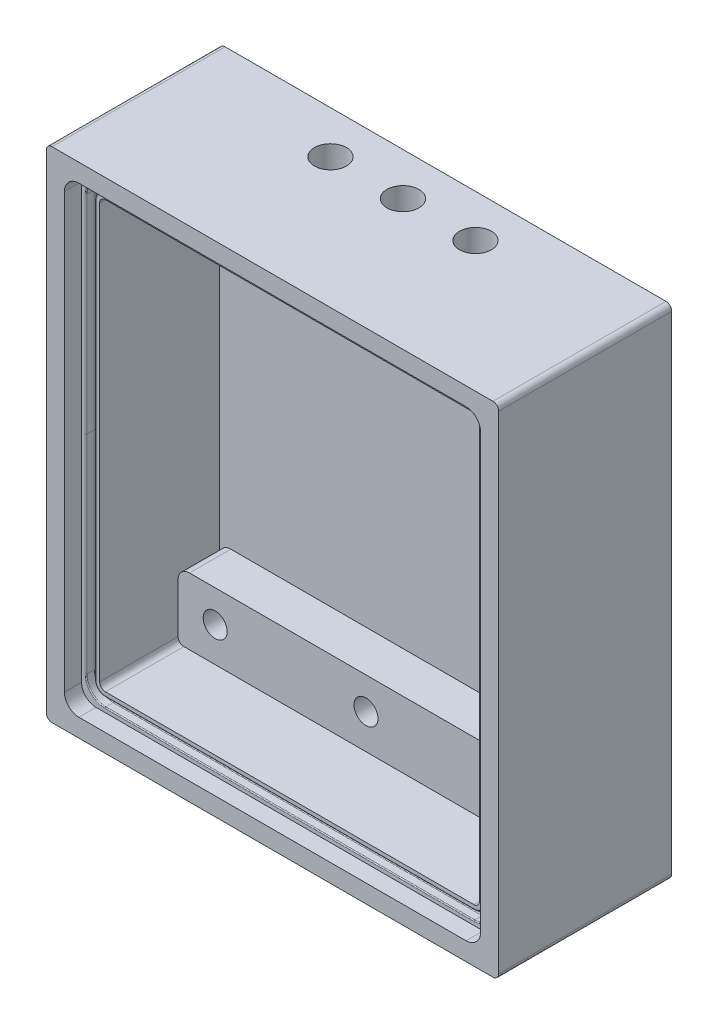
from build123d import *

# Parameters (mm, degrees)
BOSS_EXTRUDE2_DEPTH      = 20.32
BOSS_EXTRUDE2_DEPTH_BACK = 10
SKETCH1_W                = 79.247997513
SKETCH1_H                = 87.375993957
SHELL2_T                 = -6.35
SKETCH2_W                = 66.547997513
SKETCH2_H                = 11.66
BOSS_EXTRUDE3_DEPTH      = 7.23
FILLET1_R                = 1
FILLET2_R                = 2
FILLET3_R                = 2
SKETCH3_R                = 2.1
CUT_EXTRUDE2_DEPTH       = 5
CUT_EXTRUDE3_DEPTH       = 3
SKETCH5_W                = 1.5875
SKETCH5_H                = 3.175
SKETCH7_R                = 2.8067
CUT_EXTRUDE4_DEPTH       = 4.699
FILLET4_R                = 0.15875
FILLET5_R                = 0.15875


with BuildPart() as part:
    # Sketch1 → Boss-Extrude2 (new, two sides: drawn at the far end of the back side and taken through both)
    with BuildSketch(Plane.XY.offset(-BOSS_EXTRUDE2_DEPTH_BACK)):
        with Locations((52.069998742, 103.917747498)):
            Rectangle(SKETCH1_W, SKETCH1_H)
    extrude(amount=BOSS_EXTRUDE2_DEPTH + BOSS_EXTRUDE2_DEPTH_BACK)

    # Shell2
    shell2_openings = [part.faces().sort_by_distance(p)[0] for p in [
        (52.069998741, 103.917747498, 20.32),
    ]]
    offset(amount=SHELL2_T, openings=shell2_openings, kind=Kind.INTERSECTION)

    # Fillet1
    fillet1_edges = [part.edges().sort_by_distance(p)[0] for p in [
        (18.795999985, 66.579750519, 8.335),
        (18.795999985, 141.255744476, 8.335),
        (85.343997498, 141.255744476, 8.335),
        (85.343997498, 66.579750519, 8.335),
        (12.445999985, 147.605744476, 5.16),
        (91.693997498, 147.605744476, 5.16),
        (91.693997498, 60.229750519, 5.16),
        (12.445999985, 60.229750519, 5.16),
    ]]
    fillet(fillet1_edges, radius=FILLET1_R)

    # Sketch4 → Cut-Extrude3 (cut)
    with BuildSketch(Plane.XY.offset(20.32)):
        with BuildLine():
            Line((18.160999985, 144.430744476), (85.978997498, 144.430744476))
            ThreePointArc((85.978997498, 144.430744476), (87.775048722, 143.686795701), (88.518997498, 141.890744476))
            Line((88.518997498, 141.890744476), (88.518997498, 65.944750519))
            ThreePointArc((88.518997498, 65.944750519), (87.775048722, 64.148699295), (85.978997498, 63.404750519))
            Line((85.978997498, 63.404750519), (18.160999985, 63.404750519))
            ThreePointArc((18.160999985, 63.404750519), (16.364948761, 64.148699295), (15.620999985, 65.944750519))
            Line((15.620999985, 65.944750519), (15.620999985, 141.890744476))
            ThreePointArc((15.620999985, 141.890744476), (16.364948761, 143.686795701), (18.160999985, 144.430744476))
        make_face()
    extrude(amount=-CUT_EXTRUDE3_DEPTH, mode=Mode.SUBTRACT)

    # Cut-Sweep1: sweep along a path in Sketch6
    with BuildLine(Plane.XY.offset(17.32)) as cut_sweep1_path:
        Line((19.748499985, 142.843244476), (84.391497498, 142.843244476))
        ThreePointArc((84.391497498, 142.843244476), (86.187548722, 142.099295701), (86.931497498, 140.303244476))
        Line((86.931497498, 140.303244476), (86.931497498, 67.532250519))
        ThreePointArc((86.931497498, 67.532250519), (86.187548722, 65.736199295), (84.391497498, 64.992250519))
        Line((84.391497498, 64.992250519), (19.748499985, 64.992250519))
        ThreePointArc((19.748499985, 64.992250519), (17.952448761, 65.736199295), (17.208499985, 67.532250519))
        Line((17.208499985, 67.532250519), (17.208499985, 140.303244476))
        ThreePointArc((17.208499985, 140.303244476), (17.952448761, 142.099295701), (19.748499985, 142.843244476))
    # Sketch5 → Cut-Sweep1 (sweep, cut)
    with BuildSketch(Plane(origin=(0, 103.917747498, 0), x_dir=(1, 0, 0), z_dir=(0, 1, 0))):
        with Locations((17.208499985, -17.32)):
            Rectangle(SKETCH5_W, SKETCH5_H)
    sweep(path=cut_sweep1_path.line, mode=Mode.SUBTRACT)

    # Sketch7 → Cut-Extrude4 (cut)
    with BuildSketch(Plane(origin=(0, 147.605744476, 0), x_dir=(1, 0, 0), z_dir=(0, 1, 0))):
        with Locations(Location((52.069998741, 2.54, 0), (0, 0, 270))):
            Circle(SKETCH7_R)
        with Locations(Location((64.769998741, 2.54, 0), (0, 0, 270))):
            Circle(SKETCH7_R)
        with Locations(Location((39.369998741, 2.54, 0), (0, 0, 270))):
            Circle(SKETCH7_R)
    cut_extrude4 = extrude(amount=-CUT_EXTRUDE4_DEPTH, mode=Mode.SUBTRACT)

    # Mirror13: Cut-Extrude4 across plane
    add(cut_extrude4.mirror(Plane.ZX.offset(103.917747498)), mode=Mode.SUBTRACT)

    # Fillet4
    fillet4_edges = [part.edges().sort_by_distance(p)[0] for p in [
        (18.002249985, 103.917747498, 17.32),
        (18.513714768, 141.538029693, 17.32),
        (52.069998741, 142.049494476, 17.32),
        (85.626282714, 141.538029693, 17.32),
        (86.137747498, 103.917747498, 17.32),
        (85.626282714, 66.297465302, 17.32),
        (52.069998741, 65.786000519, 17.32),
        (18.513714768, 66.297465302, 17.32),
        (18.002249985, 103.917747498, 17.32),
        (17.391182753, 142.660561708, 17.32),
        (52.069998741, 143.636994476, 17.32),
        (86.748814729, 142.660561708, 17.32),
        (87.725247498, 103.917747498, 17.32),
        (86.748814729, 65.174933287, 17.32),
        (52.069998741, 64.198500519, 17.32),
        (17.391182753, 65.174933287, 17.32),
        (16.414749985, 103.917747498, 17.32),
        (16.414749985, 103.917747498, 17.32),
    ]]
    fillet(fillet4_edges, radius=FILLET4_R)

    # Fillet5
    fillet5_edges = [part.edges().sort_by_distance(p)[0] for p in [
        (16.414749985, 103.917747498, 15.7325),
        (16.414749985, 103.917747498, 15.7325),
        (17.391182753, 65.174933287, 15.7325),
        (52.069998741, 64.198500519, 15.7325),
        (86.748814729, 65.174933287, 15.7325),
        (87.725247498, 103.917747498, 15.7325),
        (86.748814729, 142.660561708, 15.7325),
        (52.069998741, 143.636994476, 15.7325),
        (17.391182753, 142.660561708, 15.7325),
        (18.002249985, 103.917747498, 15.7325),
        (18.513714768, 66.297465302, 15.7325),
        (52.069998741, 65.786000519, 15.7325),
        (85.626282714, 66.297465302, 15.7325),
        (86.137747498, 103.917747498, 15.7325),
        (85.626282714, 141.538029693, 15.7325),
        (52.069998741, 142.049494476, 15.7325),
        (18.513714768, 141.538029693, 15.7325),
        (18.002249985, 103.917747498, 15.7325),
    ]]
    fillet(fillet5_edges, radius=FILLET5_R)


with BuildPart() as body_2:
    # Sketch2 → Boss-Extrude3 (new body)
    with BuildSketch(Plane.XY.offset(-3.65)):
        with Locations((52.069998742, 135.425744476)):
            Rectangle(SKETCH2_W, SKETCH2_H)
    extrude(amount=BOSS_EXTRUDE3_DEPTH)


with BuildPart() as body_3:
    # Mirror4: mirrored copy
    add(body_2.part.mirror(Plane(origin=(0, 103.917747498, 0), x_dir=(0, 0, 1), z_dir=(0, -1, 0))))

    # Fillet2
    fillet2_edges = [body_3.edges().sort_by_distance(p)[0] for p in [
        (85.343997498, 78.239750519, -0.035),
        (18.795999985, 78.239750519, -0.035),
    ]]
    fillet(fillet2_edges, radius=FILLET2_R)

    # Sketch3 → Cut-Extrude2 (cut)
    with BuildSketch(Plane.XY.offset(3.58)):
        with Locations((25.292, 72.644)):
            Circle(SKETCH3_R)
        with Locations((51.708, 72.644)):
            Circle(SKETCH3_R)
        with Locations((79.14, 72.644)):
            Circle(SKETCH3_R)
    cut_extrude2 = extrude(amount=-CUT_EXTRUDE2_DEPTH, mode=Mode.SUBTRACT)


with BuildPart() as body_2_1:
    add(body_2.part)

    # Fillet3
    fillet3_edges = [body_2_1.edges().sort_by_distance(p)[0] for p in [
        (85.343997498, 129.595744476, -0.035),
        (18.795999985, 129.595744476, -0.035),
    ]]
    fillet(fillet3_edges, radius=FILLET3_R)

    # Mirror12: Cut-Extrude2 across plane
    add(cut_extrude2.mirror(Plane(origin=(0, 103.917747498, 0), x_dir=(0, 0, 1), z_dir=(0, -1, 0))), mode=Mode.SUBTRACT)


solid = Compound([part.part, body_3.part, body_2_1.part])
